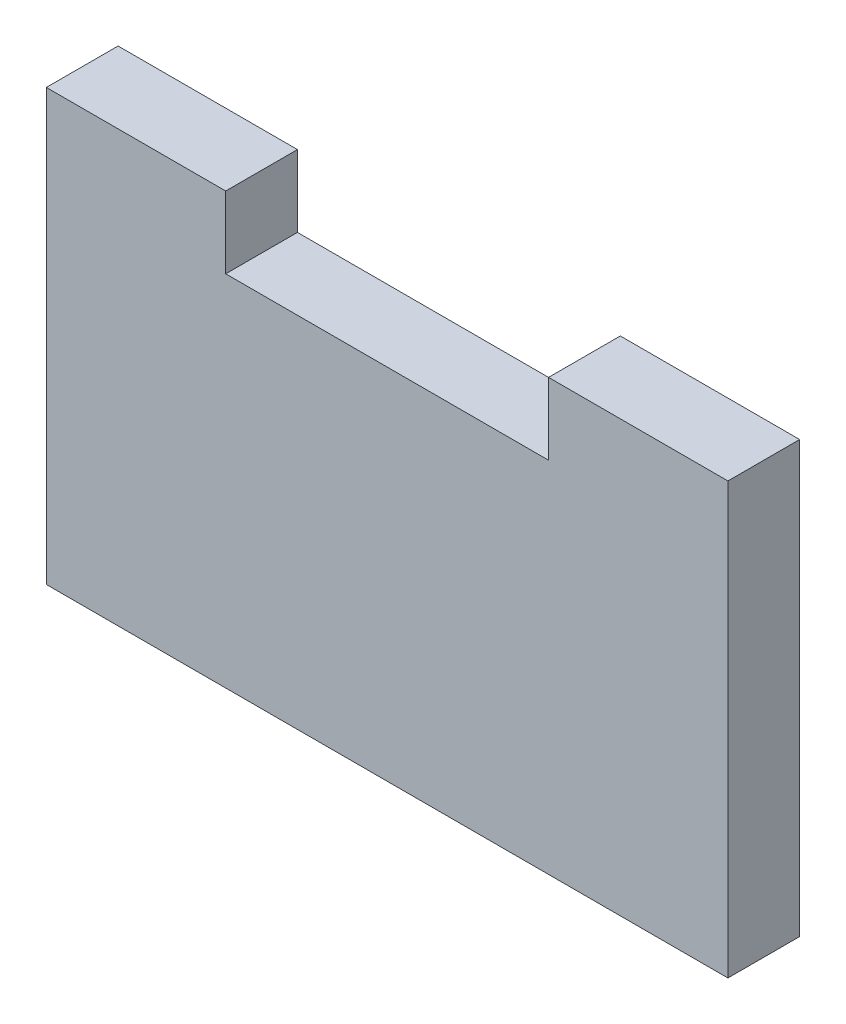
from build123d import *

# Parameters (mm, degrees)
BOSS_EXTRUDE1_DEPTH = 4


with BuildPart() as part:
    # Sketch1 → Boss-Extrude1 (new body)
    with BuildSketch(Plane.XY):
        Polygon((-19, 10), (-19, 14), (-9, 14), (-9, 10), (9, 10), (9, 14), (19, 14), (19, 10), (19, -10), (-19, -10), align=None)
    extrude(amount=BOSS_EXTRUDE1_DEPTH)


solid = part.part
